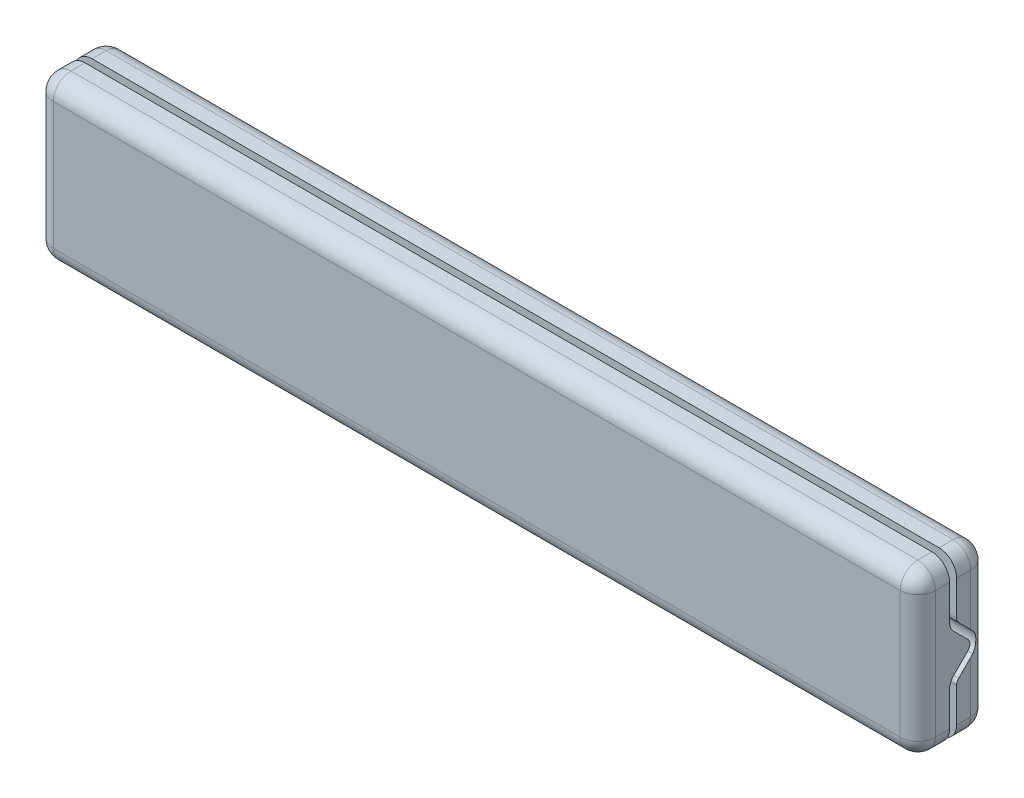
from build123d import *

# Parameters (mm, degrees)
SKETCH_1_W          = 250
SKETCH_1_H          = 46
EXTRUDE_1_DEPTH     = 10
FILLET_1_R          = 5
CUT_EXTRUDE_1_DEPTH = 252.254850699


with BuildPart() as part:
    # Эскиз1 → Бобышка-Вытянуть1 (new, symmetric)
    with BuildSketch(Plane.XY):
        with Locations((378, 0)):
            Rectangle(SKETCH_1_W, SKETCH_1_H)
    extrude(amount=EXTRUDE_1_DEPTH, both=True)

    # Скругление1
    fillet_1_edges = [part.edges().sort_by_distance(p)[0] for p in [
        (378, -23, -10),
        (253, -23, 0),
        (253, 0, -10),
        (503, -23, 0),
        (503, 0, -10),
        (378, -23, 10),
        (253, 0, 10),
        (503, 0, 10),
        (503, 23, 0),
        (378, 23, 10),
        (253, 23, 0),
        (378, 23, -10),
    ]]
    fillet(fillet_1_edges, radius=FILLET_1_R)

    # Эскиз3 → Вырез-Вытянуть1 (cut, through all)
    with BuildSketch(Plane(origin=(503, 0, 0), x_dir=(0, 0, -1), z_dir=(1, 0, 0))):
        with BuildLine():
            Line((1.585786438, -6.828427125), (5.585786438, -2.828427125))
            ThreePointArc((5.585786438, -2.828427125), (6.757359313, 0), (5.585786438, 2.828427125))
            Line((5.585786438, 2.828427125), (1.585786438, 6.828427125))
            ThreePointArc((1.585786438, 6.828427125), (1.152240935, 7.477273822), (1, 8.242640687))
            Line((1, 8.242640687), (1, 49.262457351))
            Line((1, 49.262457351), (-1, 49.262457351))
            Line((-1, 49.262457351), (-1, 8.242640687))
            ThreePointArc((-1, 8.242640687), (-0.69551813, 6.711906958), (0.171572875, 5.414213562))
            Line((0.171572875, 5.414213562), (4.171572875, 1.414213562))
            ThreePointArc((4.171572875, 1.414213562), (4.757359313, 0), (4.171572875, -1.414213562))
            Line((4.171572875, -1.414213562), (0.171572875, -5.414213562))
            ThreePointArc((0.171572875, -5.414213562), (-0.69551813, -6.711906958), (-1, -8.242640687))
            Line((-1, -8.242640687), (-1, -42.794712141))
            Line((-1, -42.794712141), (1, -42.794712141))
            Line((1, -42.794712141), (1, -8.242640687))
            ThreePointArc((1, -8.242640687), (1.152240935, -7.477273822), (1.585786438, -6.828427125))
        make_face()
    extrude(amount=-CUT_EXTRUDE_1_DEPTH, mode=Mode.SUBTRACT)


with BuildPart() as cut_extrude_1_piece_1:
    # of the separate pieces the step leaves, piece 1, a body of its own (cut_extrude_1_pieces)
    add(part.part.solids().sort_by_distance((258, -23, 5))[0])


with BuildPart() as cut_extrude_1_piece_2:
    # of the separate pieces the step leaves, piece 2, a body of its own (cut_extrude_1_pieces)
    add(part.part.solids().sort_by_distance((258, -23, -1))[0])


solid = Compound([cut_extrude_1_piece_1.part, cut_extrude_1_piece_2.part])
